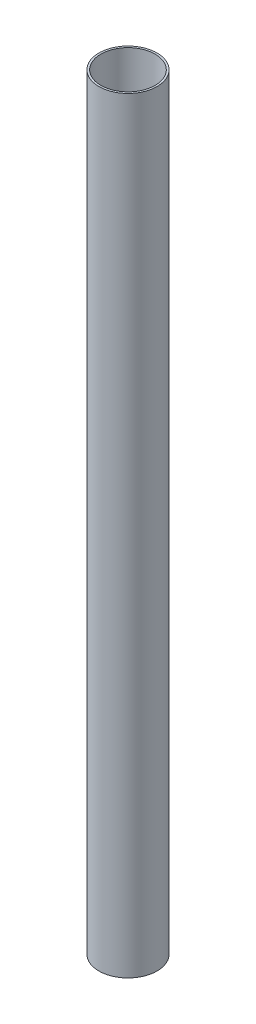
from build123d import *

# Parameters (mm, degrees)
SKETCH1_W = 1.9304
SKETCH1_H = 762


with BuildPart() as part:
    # Sketch1 → Revolve1 (revolve)
    with BuildSketch(Plane.XY, mode=Mode.PRIVATE) as revolve1_sk:
        with Locations((27.9527, -340.613767116)):
            Rectangle(SKETCH1_W, SKETCH1_H)
    revolve(revolve1_sk.sketch.rotate(Axis((0, 0, 0), (0, -1, 0)), 90), axis=Axis((0, 0, 0), (0, -1, 0)))


solid = part.part
